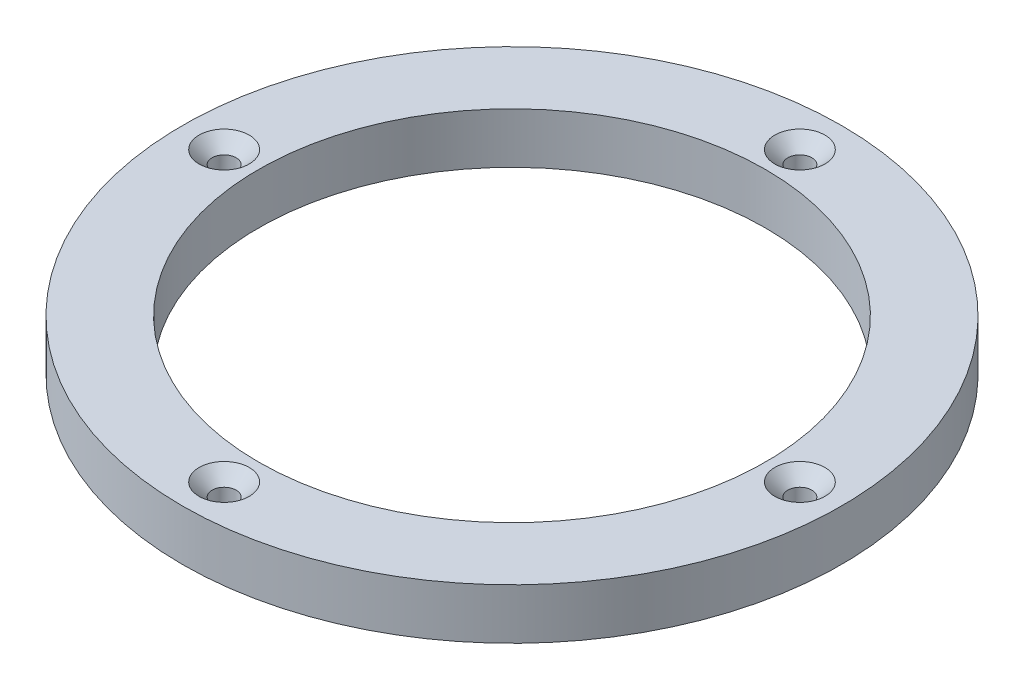
from build123d import *

# Parameters (mm, degrees)
SKETCH1_R                                           = 61.765082955
SKETCH1_R_2                                         = 47.5
BOSS_EXTRUDE1_DEPTH                                 = 9.5
SKETCH7_R                                           = 2.25
CUT_EXTRUDE1_DEPTH                                  = 9.5
CSK_FOR_M4_COUNTERSUNK_FLAT_HEAD_SCREW1_D           = 4.5
CSK_FOR_M4_COUNTERSUNK_FLAT_HEAD_SCREW1_CSINK_D     = 9.4
CSK_FOR_M4_COUNTERSUNK_FLAT_HEAD_SCREW1_CSINK_ANGLE = 90


with BuildPart() as part:
    # Sketch1 → Boss-Extrude1 (new body)
    with BuildSketch(Plane(origin=(0, 0, 0), x_dir=(1, 0, 0), z_dir=(0, 1, 0))):
        with Locations(Location((0, 0, 0), (0, 0, 270))):
            Circle(SKETCH1_R)
        with Locations(Location((0, 0, 0), (0, 0, 270))):
            Circle(SKETCH1_R_2, mode=Mode.SUBTRACT)
    extrude(amount=BOSS_EXTRUDE1_DEPTH)

    # Sketch7 → Cut-Extrude1 (cut)
    with BuildSketch(Plane(origin=(0, 9.5, 0), x_dir=(1, 0, 0), z_dir=(0, 1, 0))):
        with Locations(Location((0, 53.95, 0), (0, 0, 270))):
            Circle(SKETCH7_R)
        with Locations(Location((0, -53.95, 0), (0, 0, 90))):
            Circle(SKETCH7_R)
        with Locations(Location((53.95, 0, 0), (0, 0, 270))):
            Circle(SKETCH7_R)
        with Locations(Location((-53.95, 0, 0), (0, 0, 90))):
            Circle(SKETCH7_R)
    extrude(amount=-CUT_EXTRUDE1_DEPTH, mode=Mode.SUBTRACT)

    # CSK for M4 Countersunk Flat Head Screw1 (through all)
    with Locations(Plane(origin=(0, 9.5, 53.95), x_dir=(0, 0, 1), z_dir=(0, 1, 0))):
        with Locations((0, 0), (-53.95, -53.95), (-107.9, 0), (-53.95, 53.95)):
            CounterSinkHole(CSK_FOR_M4_COUNTERSUNK_FLAT_HEAD_SCREW1_D / 2, CSK_FOR_M4_COUNTERSUNK_FLAT_HEAD_SCREW1_CSINK_D / 2, counter_sink_angle=CSK_FOR_M4_COUNTERSUNK_FLAT_HEAD_SCREW1_CSINK_ANGLE)


solid = part.part
